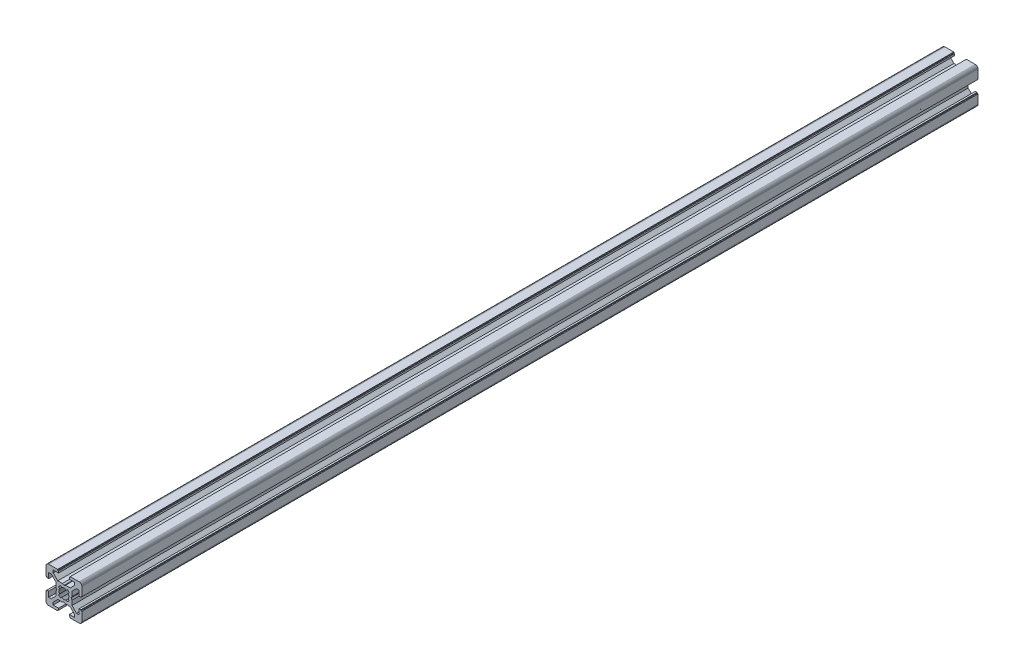
from build123d import *

# Parameters (mm, degrees)
BOSS_EXTRUDE1_DEPTH = 500


with BuildPart() as part:
    # Sketch1 → Boss-Extrude1 (new body)
    with BuildSketch(Plane.XY):
        Polygon((-70.040096267, 44.072680307), (-70.041607267, 44.139977307), (-70.041607267, 49.139977307), (-69.541607267, 49.139977307), (-69.541607267, 49.639977307), (-68.541607267, 49.639977307), (-68.541607267, 46.639977307), (-67.102267267, 46.639977307), (-64.541607267, 49.200637307), (-64.541607267, 51.773952307), (-64.041607267, 52.639977307), (-64.541607267, 53.506002307), (-64.541607267, 56.079317307), (-67.102267267, 58.639977307), (-68.541607267, 58.639977307), (-68.541607267, 55.639977307), (-69.541607267, 55.639977307), (-69.541607267, 56.139977307), (-70.041607267, 56.139977307), (-70.041607267, 61.139977307), (-70.040096267, 61.207274307), (-70.035568267, 61.274436307), (-70.028031267, 61.341327307), (-70.017501267, 61.407813307), (-70.003999267, 61.473758307), (-69.987551267, 61.539032307), (-69.968192267, 61.603503307), (-69.945959267, 61.667039307), (-69.920899267, 61.729515307), (-69.893060267, 61.790803307), (-69.862500267, 61.850780307), (-69.829280267, 61.909326307), (-69.793467267, 61.966322307), (-69.755133267, 62.021655307), (-69.714355267, 62.075212307), (-69.671214267, 62.126885307), (-69.625799267, 62.176571307), (-69.578201267, 62.224169307), (-69.528515267, 62.269584307), (-69.476842267, 62.312725307), (-69.423285267, 62.353503307), (-69.367952267, 62.391837307), (-69.310956267, 62.427650307), (-69.252410267, 62.460870307), (-69.192433267, 62.491430307), (-69.131145267, 62.519269307), (-69.068669267, 62.544329307), (-69.005133267, 62.566562307), (-68.940662267, 62.585921307), (-68.875388267, 62.602369307), (-68.809443267, 62.615871307), (-68.742957267, 62.626401307), (-68.676066267, 62.633938307), (-68.608904267, 62.638466307), (-68.541607267, 62.639977307), (-63.541607267, 62.639977307), (-63.541607267, 62.139977307), (-63.041607267, 62.139977307), (-63.041607267, 61.139977307), (-66.041607267, 61.139977307), (-66.041607267, 59.700637307), (-63.480947267, 57.139977307), (-60.907632267, 57.139977307), (-60.041607267, 56.639977307), (-59.175582267, 57.139977307), (-56.602267267, 57.139977307), (-54.041607267, 59.700637307), (-54.041607267, 61.139977307), (-57.041607267, 61.139977307), (-57.041607267, 62.139977307), (-56.541607267, 62.139977307), (-56.541607267, 62.639977307), (-51.541607267, 62.639977307), (-51.474310267, 62.638466307), (-51.407148267, 62.633938307), (-51.340257267, 62.626401307), (-51.273771267, 62.615871307), (-51.207826267, 62.602369307), (-51.142552267, 62.585921307), (-51.078081267, 62.566562307), (-51.014545267, 62.544329307), (-50.952069267, 62.519269307), (-50.890781267, 62.491430307), (-50.830804267, 62.460870307), (-50.772258267, 62.427650307), (-50.715262267, 62.391837307), (-50.659929267, 62.353503307), (-50.606372267, 62.312725307), (-50.554699267, 62.269584307), (-50.505013267, 62.224169307), (-50.457415267, 62.176571307), (-50.412000267, 62.126885307), (-50.368859267, 62.075212307), (-50.328081267, 62.021655307), (-50.289747267, 61.966322307), (-50.253934267, 61.909326307), (-50.220714267, 61.850780307), (-50.190154267, 61.790803307), (-50.162315267, 61.729515307), (-50.137255267, 61.667039307), (-50.115022267, 61.603503307), (-50.095663267, 61.539032307), (-50.079215267, 61.473758307), (-50.065713267, 61.407813307), (-50.055183267, 61.341327307), (-50.047646267, 61.274436307), (-50.043118267, 61.207274307), (-50.041607267, 61.139977307), (-50.041607267, 56.139977307), (-50.541607267, 56.139977307), (-50.541607267, 55.639977307), (-51.541607267, 55.639977307), (-51.541607267, 58.639977307), (-52.980947267, 58.639977307), (-55.541607267, 56.079317307), (-55.541607267, 53.506002307), (-56.041607267, 52.639977307), (-55.541607267, 51.773952307), (-55.541607267, 49.200637307), (-52.980947267, 46.639977307), (-51.541607267, 46.639977307), (-51.541607267, 49.639977307), (-50.541607267, 49.639977307), (-50.541607267, 49.139977307), (-50.041607267, 49.139977307), (-50.041607267, 44.139977307), (-50.043118267, 44.072680307), (-50.047646267, 44.005518307), (-50.055183267, 43.938627307), (-50.065713267, 43.872141307), (-50.079215267, 43.806196307), (-50.095663267, 43.740922307), (-50.115022267, 43.676451307), (-50.137255267, 43.612915307), (-50.162315267, 43.550439307), (-50.190154267, 43.489151307), (-50.220714267, 43.429174307), (-50.253934267, 43.370628307), (-50.289747267, 43.313632307), (-50.328081267, 43.258299307), (-50.368859267, 43.204742307), (-50.412000267, 43.153069307), (-50.457415267, 43.103383307), (-50.505013267, 43.055785307), (-50.554699267, 43.010370307), (-50.606372267, 42.967229307), (-50.659929267, 42.926451307), (-50.715262267, 42.888117307), (-50.772258267, 42.852304307), (-50.830804267, 42.819084307), (-50.890781267, 42.788524307), (-50.952069267, 42.760685307), (-51.014545267, 42.735625307), (-51.078081267, 42.713392307), (-51.142552267, 42.694033307), (-51.207826267, 42.677585307), (-51.273771267, 42.664083307), (-51.340257267, 42.653553307), (-51.407148267, 42.646016307), (-51.474310267, 42.641488307), (-51.541607267, 42.639977307), (-56.541607267, 42.639977307), (-56.541607267, 43.139977307), (-57.041607267, 43.139977307), (-57.041607267, 44.139977307), (-54.041607267, 44.139977307), (-54.041607267, 45.579317307), (-56.602267267, 48.139977307), (-59.175582267, 48.139977307), (-60.041607267, 48.639977307), (-60.907632267, 48.139977307), (-63.480947267, 48.139977307), (-66.041607267, 45.579317307), (-66.041607267, 44.139977307), (-63.041607267, 44.139977307), (-63.041607267, 43.139977307), (-63.541607267, 43.139977307), (-63.541607267, 42.639977307), (-68.541607267, 42.639977307), (-68.608904267, 42.641488307), (-68.676066267, 42.646016307), (-68.742957267, 42.653553307), (-68.809443267, 42.664083307), (-68.875388267, 42.677585307), (-68.940662267, 42.694033307), (-69.005133267, 42.713392307), (-69.068669267, 42.735625307), (-69.131145267, 42.760685307), (-69.192433267, 42.788524307), (-69.252410267, 42.819084307), (-69.310956267, 42.852304307), (-69.367952267, 42.888117307), (-69.423285267, 42.926451307), (-69.476842267, 42.967229307), (-69.528515267, 43.010370307), (-69.578201267, 43.055785307), (-69.625799267, 43.103383307), (-69.671214267, 43.153069307), (-69.714355267, 43.204742307), (-69.755133267, 43.258299307), (-69.793467267, 43.313632307), (-69.829280267, 43.370628307), (-69.862500267, 43.429174307), (-69.893060267, 43.489151307), (-69.920899267, 43.550439307), (-69.945959267, 43.612915307), (-69.968192267, 43.676451307), (-69.987551267, 43.740922307), (-70.003999267, 43.806196307), (-70.017501267, 43.872141307), (-70.028031267, 43.938627307), (-70.035568267, 44.005518307), align=None)
        Polygon((-62.783620267, 52.430544307), (-62.790719267, 52.570106307), (-62.790719267, 52.709848307), (-62.783620267, 52.849410307), (-62.769441267, 52.988431307), (-62.748218267, 53.126552307), (-62.720006267, 53.263416307), (-62.684878267, 53.398671307), (-62.642925267, 53.531967307), (-62.594254267, 53.662959307), (-62.538992267, 53.791310307), (-62.477281267, 53.916688307), (-62.989364267, 54.526966307), (-62.913018267, 54.641227307), (-62.832244267, 54.752403307), (-62.747169267, 54.860322307), (-62.657923267, 54.964819307), (-62.564644267, 55.065732307), (-62.467475267, 55.162905307), (-62.366567267, 55.256189307), (-62.262074267, 55.345439307), (-62.154158267, 55.430520307), (-62.042986267, 55.511298307), (-61.928728267, 55.587650307), (-61.318462267, 55.075576307), (-61.193072267, 55.137301307), (-61.064708267, 55.192576307), (-60.933702267, 55.241259307), (-60.800392267, 55.283222307), (-60.665121267, 55.318359307), (-60.528241267, 55.346578307), (-60.390103267, 55.367806307), (-60.251065267, 55.381989307), (-60.111487267, 55.389089307), (-59.971727267, 55.389089307), (-59.832149267, 55.381989307), (-59.693111267, 55.367806307), (-59.554973267, 55.346578307), (-59.418093267, 55.318359307), (-59.282822267, 55.283222307), (-59.149512267, 55.241259307), (-59.018506267, 55.192576307), (-58.890142267, 55.137301307), (-58.764752267, 55.075576307), (-58.154486267, 55.587650307), (-58.040228267, 55.511298307), (-57.929056267, 55.430520307), (-57.821140267, 55.345439307), (-57.716647267, 55.256189307), (-57.615739267, 55.162905307), (-57.518570267, 55.065732307), (-57.425291267, 54.964819307), (-57.336045267, 54.860322307), (-57.250970267, 54.752403307), (-57.170196267, 54.641227307), (-57.093850267, 54.526966307), (-57.605933267, 53.916688307), (-57.544222267, 53.791310307), (-57.488960267, 53.662959307), (-57.440289267, 53.531967307), (-57.398336267, 53.398671307), (-57.363208267, 53.263416307), (-57.334996267, 53.126552307), (-57.313773267, 52.988431307), (-57.299594267, 52.849410307), (-57.292495267, 52.709848307), (-57.292495267, 52.570106307), (-57.299594267, 52.430544307), (-57.313773267, 52.291523307), (-57.334996267, 52.153402307), (-57.363208267, 52.016538307), (-57.398336267, 51.881283307), (-57.440289267, 51.747987307), (-57.488960267, 51.616995307), (-57.544222267, 51.488644307), (-57.605933267, 51.363266307), (-57.093850267, 50.752988307), (-57.170196267, 50.638727307), (-57.250970267, 50.527551307), (-57.336045267, 50.419632307), (-57.425291267, 50.315135307), (-57.518570267, 50.214222307), (-57.615739267, 50.117049307), (-57.716647267, 50.023765307), (-57.821140267, 49.934515307), (-57.929056267, 49.849434307), (-58.040228267, 49.768656307), (-58.154486267, 49.692304307), (-58.764752267, 50.204378307), (-58.890142267, 50.142653307), (-59.018506267, 50.087378307), (-59.149512267, 50.038695307), (-59.282822267, 49.996732307), (-59.418093267, 49.961595307), (-59.554973267, 49.933376307), (-59.693111267, 49.912148307), (-59.832149267, 49.897965307), (-59.971727267, 49.890865307), (-60.111487267, 49.890865307), (-60.251065267, 49.897965307), (-60.390103267, 49.912148307), (-60.528241267, 49.933376307), (-60.665121267, 49.961595307), (-60.800392267, 49.996732307), (-60.933702267, 50.038695307), (-61.064708267, 50.087378307), (-61.193072267, 50.142653307), (-61.318462267, 50.204378307), (-61.928728267, 49.692304307), (-62.042986267, 49.768656307), (-62.154158267, 49.849434307), (-62.262074267, 49.934515307), (-62.366567267, 50.023765307), (-62.467475267, 50.117049307), (-62.564644267, 50.214222307), (-62.657923267, 50.315135307), (-62.747169267, 50.419632307), (-62.832244267, 50.527551307), (-62.913018267, 50.638727307), (-62.989364267, 50.752988307), (-62.477281267, 51.363266307), (-62.538992267, 51.488644307), (-62.594254267, 51.616995307), (-62.642925267, 51.747987307), (-62.684878267, 51.881283307), (-62.720006267, 52.016538307), (-62.748218267, 52.153402307), (-62.769441267, 52.291523307), align=None, mode=Mode.SUBTRACT)
    extrude(amount=BOSS_EXTRUDE1_DEPTH)


solid = part.part
